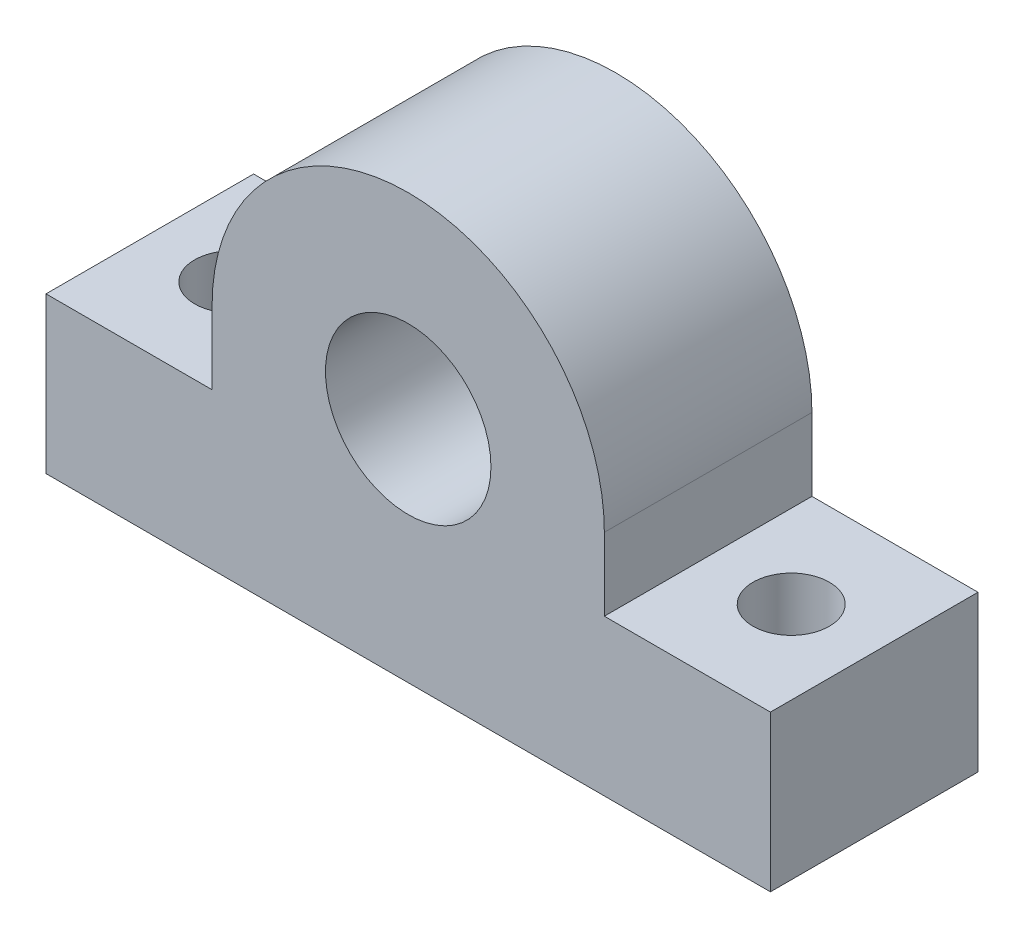
from build123d import *

# Parameters (mm, degrees)
SKETCH1_R           = 2.53125
BOSS_EXTRUDE1_DEPTH = 6.35
SKETCH2_R           = 1.1684
CUT_EXTRUDE1_DEPTH  = 6.35


with BuildPart() as part:
    # Sketch1 → Boss-Extrude1 (new body)
    with BuildSketch(Plane.XY):
        with BuildLine():
            Line((-6, 0), (-6, -2.2225))
            Line((-6, -2.2225), (-11.08, -2.2225))
            Line((-11.08, -2.2225), (-11.08, -6.985))
            Line((-11.08, -6.985), (11.08, -6.985))
            Line((11.08, -6.985), (11.08, -2.2225))
            Line((11.08, -2.2225), (6, -2.2225))
            Line((6, -2.2225), (6, 0))
            ThreePointArc((6, 0), (0, 6), (-6, 0))
        make_face()
        Circle(SKETCH1_R, mode=Mode.SUBTRACT)
    extrude(amount=BOSS_EXTRUDE1_DEPTH)

    # Sketch2 → Cut-Extrude1 (cut)
    with BuildSketch(Plane(origin=(0, -2.2225, 0), x_dir=(1, 0, 0), z_dir=(0, 1, 0))):
        with Locations(Location((-8.54, -3.175, 0), (0, 0, 270))):
            Circle(SKETCH2_R)
        with Locations(Location((8.54, -3.175, 0), (0, 0, 270))):
            Circle(SKETCH2_R)
    extrude(amount=-CUT_EXTRUDE1_DEPTH, mode=Mode.SUBTRACT)


solid = part.part
